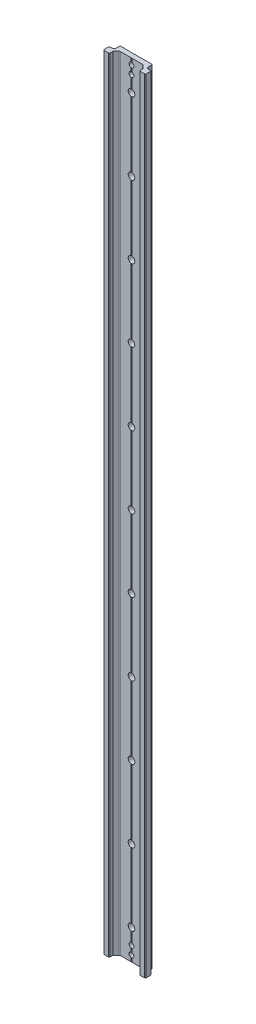
from build123d import *

# Parameters (mm, degrees)
BOSS_EXTRU_1_DEPTH                  = 650
ENL_V_MAT_EXTRU_1_DEPTH             = 651.254758327
ENL_V_MAT_EXTRU_2_DEPTH             = 650
ENL_V_MAT_EXTRU_3_DEPTH             = 651.254758327
ENL_V_MAT_EXTRU_4_DEPTH             = 650
DIAM_TRE_DU_PER_AGE_5_5_5_5_1_D     = 5.5
DIAM_TRE_DU_PER_AGE_5_5_5_5_1_DEPTH = 9.900000103
CHANFREIN1_SIZE2                    = 0.499999975
CHANFREIN1_SIZE                     = 0.5
CHANFREIN2_SIZE                     = 0.3
CHANFREIN3_SIZE2                    = 0.500000028
CHANFREIN3_SIZE                     = 0.499999997
CHANFREIN4_SIZE                     = 0.5
CHANFREIN4_SIZE2                    = 0.500000014
CONG_1_R                            = 1.499999963
CONG_2_R                            = 1.999999944
ESQUISSE8_R                         = 2
ENL_V_MAT_EXTRU_5_DEPTH             = 10


with BuildPart() as part:
    # Esquisse1 → Boss.-Extru.1 (new body)
    with BuildSketch(Plane(origin=(0, 325, 0), x_dir=(1, 0, 0), z_dir=(0, 1, 0))):
        Polygon((-9.70002034, 1.00000045), (9.70002034, 1.00000045), (12.50002072, -1.79999993), (12.50002072, -4.999999928), (17.50002072, -4.999999928), (17.50002072, 5.000000175), (-17.50002072, 5.000000175), (-17.50002072, -4.999999928), (-12.50002072, -4.999999928), (-12.50002072, -1.79999993), align=None)
    extrude(amount=-BOSS_EXTRU_1_DEPTH)

    # Esquisse2 → Enlèv. mat.-Extru.1 (cut, through all)
    with BuildSketch(Plane.XZ.offset(325)):
        Polygon((-14.30002069, -6.7e-08), (-17.50002072, -6.7e-08), (-17.50002072, -5.000000175), (-13.50002072, -5.000000175), (-13.50002072, -0.799999947), align=None)
    extrude(amount=-ENL_V_MAT_EXTRU_1_DEPTH, mode=Mode.SUBTRACT)

    # Esquisse3 → Enlèv. mat.-Extru.2 (cut)
    with BuildSketch(Plane.XZ.offset(325)):
        Polygon((0.25, -1.000000175), (-0.25, -1.000000175), (1e-09, -1.144337743), align=None)
    extrude(amount=-ENL_V_MAT_EXTRU_2_DEPTH, mode=Mode.SUBTRACT)

    # Esquisse4 → Enlèv. mat.-Extru.3 (cut, through all)
    with BuildSketch(Plane.XZ.offset(325)):
        Polygon((13.50002072, -0.799999925), (13.50002072, -5.000000175), (17.50002072, -5.000000175), (17.50002072, 7.5e-08), (14.30002072, 7.5e-08), align=None)
    extrude(amount=-ENL_V_MAT_EXTRU_3_DEPTH, mode=Mode.SUBTRACT)

    # Esquisse5 → Enlèv. mat.-Extru.4 (cut)
    with BuildSketch(Plane.XZ.offset(325)):
        Polygon((-7.50002072, -5.000000175), (7.50002072, -5.000000175), (7.40002072, -4.900000175), (-7.40002072, -4.900000175), align=None)
    extrude(amount=-ENL_V_MAT_EXTRU_4_DEPTH, mode=Mode.SUBTRACT)

    # Diamètre du perçage Ø5.5 (5.5)1
    with Locations(Plane(origin=(0, 0, -4.900000175), x_dir=(-1, 0, 0), z_dir=(0, 0, -1))):
        with Locations((0, 300), (0, 240), (0, 180), (0, 120), (0, 60), (0, 0), (0, -60), (0, -120), (0, -180), (0, -240), (0, -300)):
            Hole(DIAM_TRE_DU_PER_AGE_5_5_5_5_1_D / 2, depth=DIAM_TRE_DU_PER_AGE_5_5_5_5_1_DEPTH)

    # Chanfrein1
    chanfrein1_edges = [part.edges().sort_by_distance(p)[0] for p in [
        (-17.50002072, 0, 4.999999928),
        (17.50002072, 0, 4.999999928),
    ]]
    chamfer(chanfrein1_edges, length=CHANFREIN1_SIZE, length2=CHANFREIN1_SIZE2)

    # Chanfrein2
    chanfrein2_edges = [part.edges().sort_by_distance(p)[0] for p in [
        (-13.50002072, 0, -5.000000175),
        (13.50002072, 0, -5.000000175),
    ]]
    chamfer(chanfrein2_edges, length=CHANFREIN2_SIZE)

    # Chanfrein3
    chanfrein3_edges = [part.edges().sort_by_distance(p)[0] for p in [
        (-12.50002072, 0, 4.999999928),
        (12.50002072, 0, 4.999999928),
        (-17.50002072, 0, -6.7e-08),
    ]]
    chamfer(chanfrein3_edges, length=CHANFREIN3_SIZE, length2=CHANFREIN3_SIZE2)

    # Chanfrein4
    chanfrein4_edges = [part.edges().sort_by_distance(p)[0] for p in [
        (17.50002072, 0, 7.5e-08),
    ]]
    chanfrein4_side = [part.faces().sort_by_distance(p)[0] for p in [
        (15.90002072, 0, 7.5e-08),
    ]]
    chamfer(chanfrein4_edges, length=CHANFREIN4_SIZE, length2=CHANFREIN4_SIZE2, reference=chanfrein4_side[0])

    # Congé1
    cong_1_edges = [part.edges().sort_by_distance(p)[0] for p in [
        (9.70002034, 0, -1.00000045),
        (-9.70002034, 0, -1.00000045),
    ]]
    fillet(cong_1_edges, radius=CONG_1_R)

    # Congé2
    cong_2_edges = [part.edges().sort_by_distance(p)[0] for p in [
        (-13.50002072, 0, -0.799999947),
        (13.50002072, 0, -0.799999925),
    ]]
    fillet(cong_2_edges, radius=CONG_2_R)

    # Esquisse8 → Enlèv. mat.-Extru.5 (cut)
    with BuildSketch(Plane.XY.offset(-1.00000045)):
        with Locations((1e-09, -313)):
            Circle(ESQUISSE8_R)
        with Locations((1e-09, 313)):
            Circle(ESQUISSE8_R)
        with Locations((0, -320)):
            Circle(ESQUISSE8_R)
        with Locations((0, 320)):
            Circle(ESQUISSE8_R)
    extrude(amount=-ENL_V_MAT_EXTRU_5_DEPTH, mode=Mode.SUBTRACT)


solid = part.part
